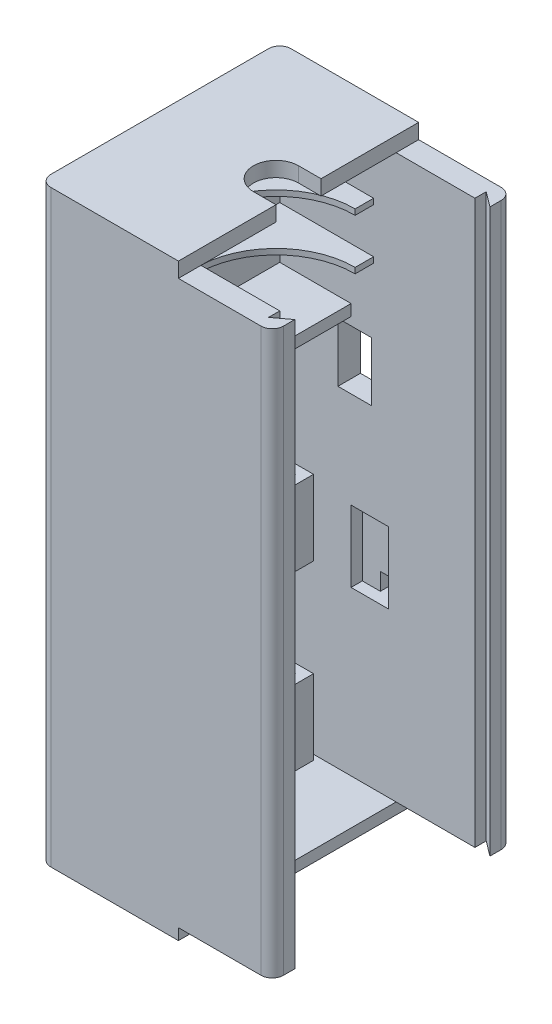
from build123d import *

# Parameters (mm, degrees)
CROQUIS1_W              = 31
CROQUIS1_H              = 32
SALIENTE_EXTRUIR1_DEPTH = 78.4
CORTAR_EXTRUIR1_START   = -2
CROQUIS2_W              = 26
CROQUIS2_H              = 20.4
CROQUIS2_H_2            = 53
CORTAR_EXTRUIR1_DEPTH   = 26
CROQUIS3_R              = 3
CORTAR_EXTRUIR2_DEPTH   = 5
CROQUIS4_W              = 26
CROQUIS4_H              = 75.4
CORTAR_EXTRUIR3_DEPTH   = 2
CROQUIS5_W              = 22.24757215
CROQUIS5_H              = 26
CORTAR_EXTRUIR4_DEPTH   = 19
SALIENTE_EXTRUIR4_START = 6.75
SALIENTE_EXTRUIR4_DEPTH = 0.75
MATRIZL1_COUNT          = 2
MATRIZL1_PITCH          = 6.75
SALIENTE_EXTRUIR5_START = 10
SALIENTE_EXTRUIR5_DEPTH = 10
MATRIZL2_COUNT          = 2
MATRIZL2_PITCH          = 23
CORTAR_EXTRUIR8_DEPTH   = 10
CROQUIS15_W             = 12.5
CROQUIS15_H             = 32
CORTAR_EXTRUIR11_DEPTH  = 10
CROQUIS16_W             = 14.1
CROQUIS16_H             = 53
CORTAR_EXTRUIR12_DEPTH  = 10
CORTAR_EXTRUIR13_DEPTH  = 54.5
CORTAR_EXTRUIR14_DEPTH  = 95
CORTAR_EXTRUIR15_START  = -3
CROQUIS19_W             = 4.5
CROQUIS19_H             = 7.85
CROQUIS19_W_2           = 5
CROQUIS19_H_2           = 9.5
CORTAR_EXTRUIR15_DEPTH  = 1.5
CROQUIS21_W             = 4.5
CROQUIS21_H             = 7.85
CROQUIS21_W_2           = 2.6
CROQUIS21_H_2           = 2.3
CORTAR_EXTRUIR16_DEPTH  = 1.5
REDONDEO1_R             = 1.5
CROQUIS22_W             = 1.718797889
CROQUIS22_H             = 0.770495605
CORTAR_EXTRUIR17_DEPTH  = 1.5


with BuildPart() as part:
    # Croquis1 → Saliente-Extruir1 (new body)
    with BuildSketch(Plane(origin=(0, 0, 0), x_dir=(1, 0, 0), z_dir=(0, 1, 0))):
        with Locations((15.5, 16)):
            Rectangle(CROQUIS1_W, CROQUIS1_H)
    extrude(amount=SALIENTE_EXTRUIR1_DEPTH)

    # Croquis2 → Cortar-Extruir1 (cut)
    with BuildSketch(Plane(origin=(31, 0, 0), x_dir=(0, 0, -1), z_dir=(1, 0, 0)).offset(CORTAR_EXTRUIR1_START)):
        with Locations((16, 66.2)):
            Rectangle(CROQUIS2_W, CROQUIS2_H)
        with Locations((16, 28)):
            Rectangle(CROQUIS2_W, CROQUIS2_H_2)
    extrude(amount=-CORTAR_EXTRUIR1_DEPTH, mode=Mode.SUBTRACT)

    # Croquis3 → Cortar-Extruir2 (cut)
    with BuildSketch(Plane(origin=(0, 78.4, 0), x_dir=(1, 0, 0), z_dir=(0, 1, 0))):
        with Locations(Location((15.5, 16, 0), (0, 0, 270))):
            Circle(CROQUIS3_R)
    extrude(amount=-CORTAR_EXTRUIR2_DEPTH, mode=Mode.SUBTRACT)

    # Croquis4 → Cortar-Extruir3 (cut)
    with BuildSketch(Plane(origin=(31, 0, 0), x_dir=(0, 0, -1), z_dir=(1, 0, 0))):
        with Locations((16, 39.2)):
            Rectangle(CROQUIS4_W, CROQUIS4_H)
    extrude(amount=-CORTAR_EXTRUIR3_DEPTH, mode=Mode.SUBTRACT)

    # Croquis5 → Cortar-Extruir4 (cut)
    with BuildSketch(Plane.XZ.offset(-54.5)):
        with Locations((23.623786075, -16)):
            Rectangle(CROQUIS5_W, CROQUIS5_H)
    extrude(amount=-CORTAR_EXTRUIR4_DEPTH, mode=Mode.SUBTRACT)

    # Croquis11 → Saliente-Extruir4 (add)
    with BuildSketch(Plane.XZ.offset(-76.4).offset(SALIENTE_EXTRUIR4_START)):
        with BuildLine():
            Line((15.5, -3), (15.5, -5.45))
            ThreePointArc((15.5, -5.45), (4.95, -16), (15.5, -26.55))
            Line((15.5, -26.55), (15.5, -29))
            Line((15.5, -29), (3, -29))
            Line((3, -29), (3, -3))
            Line((3, -3), (15.5, -3))
        make_face()
    saliente_extruir4 = extrude(amount=SALIENTE_EXTRUIR4_DEPTH)

    # MatrizL1: Saliente-Extruir4 ×2
    with Locations(*[(0, -i * MATRIZL1_PITCH, 0) for i in range(1, MATRIZL1_COUNT)]):
        add(saliente_extruir4)

    # Croquis6 → Saliente-Extruir5 (add)
    with BuildSketch(Plane.XZ.offset(-54.5).offset(SALIENTE_EXTRUIR5_START)):
        Polygon((3, -17.1), (3, -18.3), (18.2, -18.3), (18.2, -3), (17, -3), (17, -17.1), align=None)
    saliente_extruir5 = extrude(amount=SALIENTE_EXTRUIR5_DEPTH)

    # MatrizL2: Saliente-Extruir5 ×2
    with Locations(*[(0, -i * MATRIZL2_PITCH, 0) for i in range(1, MATRIZL2_COUNT)]):
        add(saliente_extruir5)

    # Croquis14 → Cortar-Extruir8 (cut)
    with BuildSketch(Plane.XZ.offset(-76.4)):
        Polygon((18.5, 0), (31, 0), (31, -32), (18.5, -32), (18.5, -19), (15.5, -19), (15.5, -13), (18.5, -13), align=None)
    extrude(amount=-CORTAR_EXTRUIR8_DEPTH, mode=Mode.SUBTRACT)

    # Croquis15 → Cortar-Extruir11 (cut)
    with BuildSketch(Plane(origin=(0, 1.5, 0), x_dir=(1, 0, 0), z_dir=(0, 1, 0))):
        with Locations((24.75, 16)):
            Rectangle(CROQUIS15_W, CROQUIS15_H)
    extrude(amount=-CORTAR_EXTRUIR11_DEPTH, mode=Mode.SUBTRACT)

    # Croquis16 → Cortar-Extruir12 (cut)
    with BuildSketch(Plane.ZY):
        with Locations((-10.05, 28)):
            Rectangle(CROQUIS16_W, CROQUIS16_H)
    extrude(amount=-CORTAR_EXTRUIR12_DEPTH, mode=Mode.SUBTRACT)

    # Croquis17 → Cortar-Extruir13 (cut)
    with BuildSketch(Plane.XZ):
        Polygon((0, -17.1), (2, -19.1), (2, -1), (0, -3), align=None)
    extrude(amount=-CORTAR_EXTRUIR13_DEPTH, mode=Mode.SUBTRACT)

    # Croquis18 → Cortar-Extruir14 (cut)
    with BuildSketch(Plane(origin=(0, 76.4, 0), x_dir=(1, 0, 0), z_dir=(0, 1, 0))):
        Polygon((31, 29), (29, 30.5), (29, 29), align=None)
        Polygon((29, 3), (31, 3), (29, 1.5), align=None)
    extrude(amount=-CORTAR_EXTRUIR14_DEPTH, mode=Mode.SUBTRACT)

    # Croquis19 → Cortar-Extruir15 (cut)
    with BuildSketch(Plane(origin=(0, 0, -32), x_dir=(-1, 0, 0), z_dir=(0, 0, -1)).offset(CORTAR_EXTRUIR15_START)):
        with Locations((-13, 49.5)):
            Rectangle(CROQUIS19_W, CROQUIS19_H)
        with Locations((-15, 28)):
            Rectangle(CROQUIS19_W_2, CROQUIS19_H_2)
    extrude(amount=CORTAR_EXTRUIR15_DEPTH, mode=Mode.SUBTRACT)

    # Croquis21 → Cortar-Extruir16 (cut)
    with BuildSketch(Plane(origin=(0, 0, -32), x_dir=(-1, 0, 0), z_dir=(0, 0, -1))):
        with Locations((-13, 49.5)):
            Rectangle(CROQUIS21_W, CROQUIS21_H)
        with Locations((-16.2, 24.4)):
            Rectangle(CROQUIS21_W_2, CROQUIS21_H_2)
    extrude(amount=-CORTAR_EXTRUIR16_DEPTH, mode=Mode.SUBTRACT)

    # Redondeo1
    redondeo1_edges = [part.edges().sort_by_distance(p)[0] for p in [
        (31, 38.95, -32),
        (31, 38.95, 0),
        (0, 39.2, -32),
        (0, 39.2, 0),
    ]]
    fillet(redondeo1_edges, radius=REDONDEO1_R)

    # Croquis22 → Cortar-Extruir17 (cut)
    # profile 1 of 7: a face of its own
    with BuildSketch(Plane(origin=(0, 0, -32), x_dir=(-1, 0, 0), z_dir=(0, 0, -1))):
        Polygon((-19.530531141, 44.51172003), (-19.530531141, 47.080038715), (-19.014500765, 47.080038715), (-17.982954498, 45.39252163), (-17.982954498, 47.080038715), (-17.489047059, 47.080038715), (-17.489047059, 44.51172003), (-18.020512043, 44.51172003), (-19.036623702, 46.173512769), (-19.036623702, 44.51172003), align=None)
    # profile 2 of 7: a face of its own
    with BuildSketch(Plane(origin=(0, 0, -32), x_dir=(-1, 0, 0), z_dir=(0, 0, -1))):
        with BuildLine():
            add(Edge.make_bspline(
                [(-22.39519429, 45.780444765), (-22.395012541, 45.812182987), (-22.394655608, 45.874512759), (-22.388470798, 45.965952874), (-22.380318736, 46.053601639), (-22.367043117, 46.137114298), (-22.351426142, 46.216881719), (-22.331893451, 46.292880226), (-22.308363475, 46.364843292), (-22.289645193, 46.410790932), (-22.280463708, 46.433328661)],
                knots=[0, 0, 0, 0, 1.141009212, 2.240794809, 3.294380675, 4.305229195, 5.280013876, 6.216333343, 7.125095522, 8, 8, 8, 8], degree=3))
            add(Edge.make_bspline(
                [(-22.280463708, 46.433328661), (-22.265455464, 46.465368654), (-22.235615498, 46.529071796), (-22.180197992, 46.619089457), (-22.117385515, 46.703983406), (-22.047695188, 46.783308592), (-21.972906224, 46.85587082), (-21.892665805, 46.917973639), (-21.809824632, 46.971714394), (-21.750905751, 46.998742799), (-21.721730917, 47.012126442)],
                knots=[0, 0, 0, 0, 1.031372299, 2.050613973, 3.077158538, 4.108712802, 5.127684358, 6.111366908, 7.06480644, 8, 8, 8, 8], degree=3))
            add(Edge.make_bspline(
                [(-21.721730917, 47.012126442), (-21.701927149, 47.020249506), (-21.661898683, 47.036668289), (-21.599689736, 47.057159791), (-21.535120406, 47.07380821), (-21.468657718, 47.088689957), (-21.399656375, 47.098951411), (-21.328673937, 47.107555288), (-21.255321942, 47.112064729), (-21.205705722, 47.112662228), (-21.180490681, 47.112965877)],
                knots=[0, 0, 0, 0, 0.92659354, 1.872881803, 2.832850937, 3.813025581, 4.820167273, 5.851730198, 6.908245912, 8, 8, 8, 8], degree=3))
            add(Edge.make_bspline(
                [(-21.180490681, 47.112965877), (-21.135341198, 47.111834128), (-21.046983039, 47.109619279), (-20.91791658, 47.093621689), (-20.795780523, 47.066608285), (-20.680988299, 47.027563903), (-20.572550206, 46.978757578), (-20.471308743, 46.918218891), (-20.37711407, 46.846603053), (-20.290148121, 46.76489215), (-20.211829054, 46.673228581), (-20.143619654, 46.572468622), (-20.086401188, 46.463084443), (-20.039278479, 46.345377841), (-20.003068227, 46.218964347), (-19.976906354, 46.08420065), (-19.961364083, 45.940987487), (-19.959527485, 45.842736913), (-19.958584256, 45.792277964)],
                knots=[0, 0, 0, 0, 1.064641025, 2.083517118, 3.061799897, 4.009540929, 4.938075217, 5.861300345, 6.78508344, 7.723570974, 8.670267188, 9.622657076, 10.586935816, 11.576069104, 12.607749008, 13.683335114, 14.81022093, 16, 16, 16, 16], degree=3))
            add(Edge.make_bspline(
                [(-19.958584256, 45.792277964), (-19.959505699, 45.742156895), (-19.961299577, 45.644580537), (-19.977131954, 45.502491173), (-20.002209195, 45.368709908), (-20.03929559, 45.243542346), (-20.085011885, 45.126033376), (-20.142819143, 45.017582623), (-20.209600032, 44.916751559), (-20.287807861, 44.826075737), (-20.373310124, 44.743895894), (-20.467385315, 44.673117066), (-20.56788979, 44.612496352), (-20.675736659, 44.563548985), (-20.790222994, 44.525308708), (-20.911722416, 44.498087726), (-21.040297237, 44.482151696), (-21.128311125, 44.479928806), (-21.173287864, 44.478792867)],
                knots=[0, 0, 0, 0, 1.18845052, 2.313691126, 3.386664782, 4.412527756, 5.405809582, 6.372003093, 7.321919452, 8.268293321, 9.206237639, 10.129603466, 11.054616372, 11.9847576, 12.932764752, 13.912672021, 14.933336461, 16, 16, 16, 16], degree=3))
            add(Edge.make_bspline(
                [(-21.173287864, 44.478792867), (-21.218778356, 44.479931427), (-21.307816316, 44.482159916), (-21.437762507, 44.498047437), (-21.560468017, 44.52527738), (-21.675845469, 44.563652167), (-21.784681756, 44.611855964), (-21.885972036, 44.671857223), (-21.979772301, 44.743084306), (-22.065988985, 44.82429682), (-22.144148455, 44.914706053), (-22.210834525, 45.014888802), (-22.268644798, 45.122280262), (-22.314601446, 45.238507158), (-22.35148362, 45.362373663), (-22.376622139, 45.494592516), (-22.39248513, 45.634799815), (-22.394274731, 45.73100908), (-22.39519429, 45.780444765)],
                knots=[0, 0, 0, 0, 1.080878253, 2.11558926, 3.1052859, 4.062802436, 5.000434901, 5.928596448, 6.853693179, 7.793554778, 8.738606028, 9.68692032, 10.647726704, 11.63151566, 12.651483354, 13.714466703, 14.825613081, 16, 16, 16, 16], degree=3))
        make_face()
        with BuildLine():
            add(Edge.make_bspline(
                [(-21.901286851, 45.797422833), (-21.900793443, 45.7618962), (-21.899837969, 45.693099552), (-21.889660907, 45.593242882), (-21.874216395, 45.4998909), (-21.851502973, 45.413149558), (-21.822808886, 45.332956106), (-21.787652682, 45.259243462), (-21.746179647, 45.191901838), (-21.697317078, 45.132352912), (-21.64445161, 45.0791872), (-21.587388054, 45.03318545), (-21.527189873, 44.993591463), (-21.462815456, 44.962332145), (-21.395604551, 44.937524456), (-21.325034974, 44.919130462), (-21.250755839, 44.909030354), (-21.200069818, 44.907581916), (-21.174316838, 44.906845981)],
                knots=[0, 0, 0, 0, 1.313550922, 2.543666373, 3.708465049, 4.810029406, 5.85539231, 6.85404609, 7.825601258, 8.772642133, 9.696587791, 10.59409323, 11.479048685, 12.35559886, 13.234601248, 14.125357077, 15.047515647, 16, 16, 16, 16], degree=3))
            add(Edge.make_bspline(
                [(-21.174316838, 44.906845981), (-21.148560389, 44.907567005), (-21.09786754, 44.908986095), (-21.023679671, 44.919292714), (-20.952970245, 44.936898302), (-20.886026348, 44.961578866), (-20.822542861, 44.993334544), (-20.762575077, 45.032040917), (-20.706468665, 45.078251954), (-20.653660741, 45.130645302), (-20.60611709, 45.190589746), (-20.564997164, 45.257919748), (-20.529858281, 45.332079462), (-20.501161173, 45.41309663), (-20.479006733, 45.501123685), (-20.464192549, 45.596207203), (-20.45393319, 45.69807531), (-20.452981613, 45.768412593), (-20.452491695, 45.80462565)],
                knots=[0, 0, 0, 0, 0.949153107, 1.868086493, 2.754172764, 3.630100905, 4.492260106, 5.365378617, 6.254840125, 7.166615376, 8.102436631, 9.067266169, 10.06813181, 11.121736829, 12.23011542, 13.408501285, 14.665770308, 16, 16, 16, 16], degree=3))
            add(Edge.make_bspline(
                [(-20.452491695, 45.80462565), (-20.453045064, 45.84048905), (-20.454116715, 45.909941934), (-20.463449691, 46.010524052), (-20.478735382, 46.104100286), (-20.499984181, 46.190646394), (-20.528065803, 46.270176322), (-20.561606015, 46.342907553), (-20.602160895, 46.408460105), (-20.648672373, 46.466800037), (-20.700139465, 46.518150426), (-20.755687763, 46.563105491), (-20.815632872, 46.600510838), (-20.879389738, 46.631982363), (-20.947622137, 46.655330973), (-21.019636667, 46.672361252), (-21.095637124, 46.682848524), (-21.147701235, 46.684214477), (-21.174316838, 46.684912763)],
                knots=[0, 0, 0, 0, 1.332337092, 2.580197383, 3.749299508, 4.852775005, 5.886662144, 6.878700295, 7.822989687, 8.743523536, 9.644687758, 10.519443927, 11.392806431, 12.264866173, 13.155606721, 14.065961015, 15.011303331, 16, 16, 16, 16], degree=3))
            add(Edge.make_bspline(
                [(-21.174316838, 46.684912763), (-21.200935805, 46.684225218), (-21.253006497, 46.682880276), (-21.329125422, 46.672219372), (-21.401366821, 46.655696552), (-21.469589575, 46.631014734), (-21.533901784, 46.599845436), (-21.594065574, 46.561189293), (-21.650555016, 46.51631052), (-21.702483239, 46.464181542), (-21.749748349, 46.405330734), (-21.790322759, 46.338977196), (-21.824921358, 46.265845591), (-21.853307502, 46.185719443), (-21.874350413, 46.09837833), (-21.890523642, 46.004409237), (-21.899605927, 45.903243408), (-21.9007145, 45.833454481), (-21.901286851, 45.797422833)],
                knots=[0, 0, 0, 0, 0.981996942, 1.920933313, 2.83127778, 3.712125466, 4.592427284, 5.463259035, 6.34592384, 7.249932058, 8.173122297, 9.125107726, 10.113123258, 11.154048744, 12.256187849, 13.424658091, 14.670364834, 16, 16, 16, 16], degree=3))
        make_face(mode=Mode.SUBTRACT)
    # profile 3 of 7: a face of its own
    with BuildSketch(Plane(origin=(0, 0, -32), x_dir=(-1, 0, 0), z_dir=(0, 0, -1))):
        Polygon((-19.13540519, 52.178090356), (-19.13540519, 54.746409041), (-17.390265571, 54.746409041), (-17.390265571, 54.318355927), (-18.641497751, 54.318355927), (-18.641497751, 53.692739837), (-17.554901384, 53.692739837), (-17.554901384, 53.264686723), (-18.641497751, 53.264686723), (-18.641497751, 52.178090356), align=None)
    # profile 4 of 7: a face of its own
    with BuildSketch(Plane(origin=(0, 0, -32), x_dir=(-1, 0, 0), z_dir=(0, 0, -1))):
        Polygon((-21.308597923, 52.178090356), (-21.308597923, 54.746409041), (-19.563458304, 54.746409041), (-19.563458304, 54.318355927), (-20.814690484, 54.318355927), (-20.814690484, 53.692739837), (-19.728094117, 53.692739837), (-19.728094117, 53.264686723), (-20.814690484, 53.264686723), (-20.814690484, 52.178090356), align=None)
    # profile 5 of 7: a face of its own
    with BuildSketch(Plane(origin=(0, 0, -32), x_dir=(-1, 0, 0), z_dir=(0, 0, -1))):
        with BuildLine():
            add(Edge.make_bspline(
                [(-24.173261072, 53.446815091), (-24.173079322, 53.478553314), (-24.17272239, 53.540883085), (-24.16653758, 53.632323201), (-24.158385518, 53.719971965), (-24.145109899, 53.803484624), (-24.129492924, 53.883252046), (-24.109960233, 53.959250552), (-24.086430257, 54.031213618), (-24.067711975, 54.077161258), (-24.05853049, 54.099698988)],
                knots=[0, 0, 0, 0, 1.141009212, 2.240794809, 3.294380675, 4.305229195, 5.280013876, 6.216333343, 7.125095522, 8, 8, 8, 8], degree=3))
            add(Edge.make_bspline(
                [(-24.05853049, 54.099698988), (-24.043522246, 54.13173898), (-24.01368228, 54.195442123), (-23.958264774, 54.285459784), (-23.895452297, 54.370353732), (-23.825761969, 54.449678919), (-23.750973006, 54.522241147), (-23.670732587, 54.584343966), (-23.587891414, 54.63808472), (-23.528972533, 54.665113125), (-23.499797699, 54.678496768)],
                knots=[0, 0, 0, 0, 1.031372299, 2.050613973, 3.077158538, 4.108712802, 5.127684358, 6.111366908, 7.06480644, 8, 8, 8, 8], degree=3))
            add(Edge.make_bspline(
                [(-23.499797699, 54.678496768), (-23.47999393, 54.686619832), (-23.439965465, 54.703038615), (-23.377756518, 54.723530117), (-23.313187188, 54.740178537), (-23.2467245, 54.755060283), (-23.177723157, 54.765321738), (-23.106740719, 54.773925614), (-23.033388724, 54.778435056), (-22.983772504, 54.779032554), (-22.958557463, 54.779336204)],
                knots=[0, 0, 0, 0, 0.92659354, 1.872881803, 2.832850937, 3.813025581, 4.820167273, 5.851730198, 6.908245912, 8, 8, 8, 8], degree=3))
            add(Edge.make_bspline(
                [(-22.958557463, 54.779336204), (-22.91340798, 54.778204454), (-22.82504982, 54.775989606), (-22.695983362, 54.759992015), (-22.573847304, 54.732978611), (-22.459055081, 54.693934229), (-22.350616987, 54.645127905), (-22.249375525, 54.584589217), (-22.155180852, 54.51297338), (-22.068214903, 54.431262476), (-21.989895836, 54.339598908), (-21.921686436, 54.238838949), (-21.86446797, 54.12945477), (-21.81734526, 54.011748167), (-21.781135009, 53.885334673), (-21.754973135, 53.750570977), (-21.739430865, 53.607357813), (-21.737594267, 53.50910724), (-21.736651037, 53.45864829)],
                knots=[0, 0, 0, 0, 1.064641025, 2.083517118, 3.061799897, 4.009540929, 4.938075217, 5.861300345, 6.78508344, 7.723570974, 8.670267188, 9.622657076, 10.586935816, 11.576069104, 12.607749008, 13.683335114, 14.81022093, 16, 16, 16, 16], degree=3))
            add(Edge.make_bspline(
                [(-21.736651037, 53.45864829), (-21.737572481, 53.408527221), (-21.739366359, 53.310950863), (-21.755198736, 53.1688615), (-21.780275977, 53.035080234), (-21.817362372, 52.909912673), (-21.863078667, 52.792403703), (-21.920885924, 52.683952949), (-21.987666814, 52.583121886), (-22.065874643, 52.492446064), (-22.151376906, 52.410266221), (-22.245452097, 52.339487393), (-22.345956572, 52.278866678), (-22.453803441, 52.229919311), (-22.568289776, 52.191679035), (-22.689789198, 52.164458052), (-22.818364019, 52.148522023), (-22.906377907, 52.146299132), (-22.951354646, 52.145163194)],
                knots=[0, 0, 0, 0, 1.18845052, 2.313691126, 3.386664782, 4.412527756, 5.405809582, 6.372003093, 7.321919452, 8.268293321, 9.206237639, 10.129603466, 11.054616372, 11.9847576, 12.932764752, 13.912672021, 14.933336461, 16, 16, 16, 16], degree=3))
            add(Edge.make_bspline(
                [(-22.951354646, 52.145163194), (-22.996845138, 52.146301754), (-23.085883098, 52.148530242), (-23.215829289, 52.164417764), (-23.338534799, 52.191647707), (-23.45391225, 52.230022494), (-23.562748538, 52.278226291), (-23.664038818, 52.338227549), (-23.757839082, 52.409454633), (-23.844055767, 52.490667146), (-23.922215237, 52.58107638), (-23.988901307, 52.681259128), (-24.046711579, 52.788650588), (-24.092668228, 52.904877484), (-24.129550402, 53.028743989), (-24.154688921, 53.160962842), (-24.170551912, 53.301170141), (-24.172341512, 53.397379407), (-24.173261072, 53.446815091)],
                knots=[0, 0, 0, 0, 1.080878253, 2.11558926, 3.1052859, 4.062802436, 5.000434901, 5.928596448, 6.853693179, 7.793554778, 8.738606028, 9.68692032, 10.647726704, 11.63151566, 12.651483354, 13.714466703, 14.825613081, 16, 16, 16, 16], degree=3))
        make_face()
        with BuildLine():
            add(Edge.make_bspline(
                [(-23.679353632, 53.463793159), (-23.678860225, 53.428266527), (-23.677904751, 53.359469878), (-23.667727688, 53.259613209), (-23.652283177, 53.166261227), (-23.629569754, 53.079519885), (-23.600875668, 52.999326432), (-23.565719464, 52.925613788), (-23.524246429, 52.858272165), (-23.47538386, 52.798723239), (-23.422518392, 52.745557526), (-23.365454835, 52.699555776), (-23.305256655, 52.65996179), (-23.240882238, 52.628702471), (-23.173671332, 52.603894782), (-23.103101756, 52.585500789), (-23.02882262, 52.57540068), (-22.9781366, 52.573952242), (-22.95238362, 52.573216308)],
                knots=[0, 0, 0, 0, 1.313550922, 2.543666373, 3.708465049, 4.810029406, 5.85539231, 6.85404609, 7.825601258, 8.772642133, 9.696587791, 10.59409323, 11.479048685, 12.35559886, 13.234601248, 14.125357077, 15.047515647, 16, 16, 16, 16], degree=3))
            add(Edge.make_bspline(
                [(-22.95238362, 52.573216308), (-22.926627171, 52.573937331), (-22.875934322, 52.575356422), (-22.801746453, 52.585663041), (-22.731037027, 52.603268628), (-22.66409313, 52.627949192), (-22.600609642, 52.659704871), (-22.540641858, 52.698411243), (-22.484535447, 52.744622281), (-22.431727522, 52.797015629), (-22.384183872, 52.856960072), (-22.343063946, 52.924290075), (-22.307925063, 52.998449788), (-22.279227955, 53.079466956), (-22.257073514, 53.167494012), (-22.242259331, 53.262577529), (-22.231999972, 53.364445637), (-22.231048395, 53.434782919), (-22.230558477, 53.470995976)],
                knots=[0, 0, 0, 0, 0.949153107, 1.868086493, 2.754172764, 3.630100905, 4.492260106, 5.365378617, 6.254840125, 7.166615376, 8.102436631, 9.067266169, 10.06813181, 11.121736829, 12.23011542, 13.408501285, 14.665770308, 16, 16, 16, 16], degree=3))
            add(Edge.make_bspline(
                [(-22.230558477, 53.470995976), (-22.231111846, 53.506859377), (-22.232183497, 53.57631226), (-22.241516473, 53.676894378), (-22.256802164, 53.770470612), (-22.278050962, 53.85701672), (-22.306132585, 53.936546649), (-22.339672797, 54.009277879), (-22.380227677, 54.074830432), (-22.426739155, 54.133170364), (-22.478206247, 54.184520752), (-22.533754545, 54.229475818), (-22.593699654, 54.266881165), (-22.65745652, 54.29835269), (-22.725688919, 54.321701299), (-22.797703448, 54.338731578), (-22.873703906, 54.34921885), (-22.925768017, 54.350584803), (-22.95238362, 54.35128309)],
                knots=[0, 0, 0, 0, 1.332337092, 2.580197383, 3.749299508, 4.852775005, 5.886662144, 6.878700295, 7.822989687, 8.743523536, 9.644687758, 10.519443927, 11.392806431, 12.264866173, 13.155606721, 14.065961015, 15.011303331, 16, 16, 16, 16], degree=3))
            add(Edge.make_bspline(
                [(-22.95238362, 54.35128309), (-22.979002587, 54.350595544), (-23.031073279, 54.349250602), (-23.107192204, 54.338589699), (-23.179433603, 54.322066879), (-23.247656357, 54.297385061), (-23.311968566, 54.266215762), (-23.372132355, 54.22755962), (-23.428621798, 54.182680847), (-23.48055002, 54.130551869), (-23.527815131, 54.071701061), (-23.568389541, 54.005347523), (-23.60298814, 53.932215918), (-23.631374284, 53.85208977), (-23.652417195, 53.764748657), (-23.668590423, 53.670779564), (-23.677672709, 53.569613735), (-23.678781282, 53.499824807), (-23.679353632, 53.463793159)],
                knots=[0, 0, 0, 0, 0.981996942, 1.920933313, 2.83127778, 3.712125466, 4.592427284, 5.463259035, 6.34592384, 7.249932058, 8.173122297, 9.125107726, 10.113123258, 11.154048744, 12.256187849, 13.424658091, 14.670364834, 16, 16, 16, 16], degree=3))
        make_face(mode=Mode.SUBTRACT)
    # profile 6 of 7: a face of its own
    with BuildSketch(Plane(origin=(0, 0, -32), x_dir=(-1, 0, 0), z_dir=(0, 0, -1))):
        with Locations((-23.752868183, 24.238493308)):
            Rectangle(CROQUIS22_W, CROQUIS22_H)
    # profile 7 of 7: a face of its own
    with BuildSketch(Plane(origin=(0, 0, -32), x_dir=(-1, 0, 0), z_dir=(0, 0, -1))):
        Polygon((-7.254312838, 23.260556578), (-7.254312838, 24.445934432), (-6.068934983, 24.445934432), (-6.068934983, 25.216430038), (-7.254312838, 25.216430038), (-7.254312838, 26.401807892), (-8.024808444, 26.401807892), (-8.024808444, 25.216430038), (-9.210186298, 25.216430038), (-9.210186298, 24.445934432), (-8.024808444, 24.445934432), (-8.024808444, 23.260556578), align=None)
    extrude(amount=-CORTAR_EXTRUIR17_DEPTH, mode=Mode.SUBTRACT)


solid = part.part
